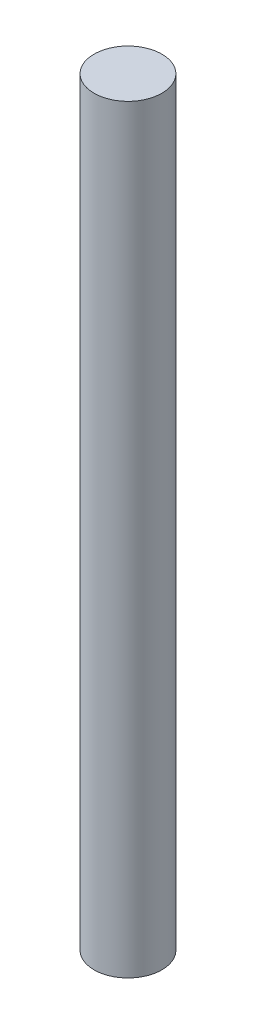
from build123d import *

# Parameters (mm, degrees)
SKETCH2_R           = 2.5
BOSS_EXTRUDE1_DEPTH = 28


with BuildPart() as part:
    # Sketch2 → Boss-Extrude1 (new, symmetric)
    with BuildSketch(Plane(origin=(0, 0, 0), x_dir=(1, 0, 0), z_dir=(0, 1, 0))):
        with Locations(Location((0, 0, 0), (0, 0, 270))):
            Circle(SKETCH2_R)
    extrude(amount=BOSS_EXTRUDE1_DEPTH, both=True)


solid = part.part
